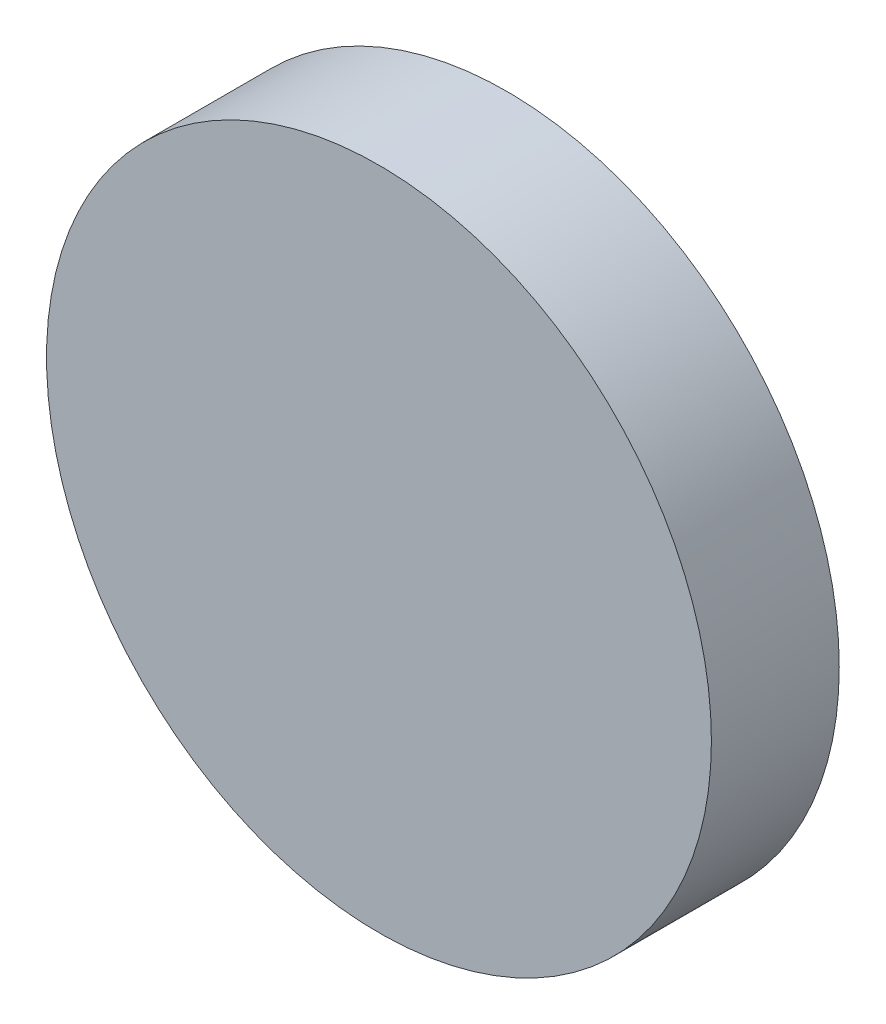
from build123d import *

# Parameters (mm, degrees)
SKETCH_1_R      = 130
EXTRUDE_1_DEPTH = 50
SKETCH_4_R      = 10
EXTRUDE_4_DEPTH = 10


with BuildPart() as part:
    # 草图1 → 凸台-拉伸1 (new body)
    with BuildSketch(Plane.XY):
        Circle(SKETCH_1_R)
    extrude(amount=EXTRUDE_1_DEPTH)

    # 草图4 → 凸台-拉伸4 (add)
    with BuildSketch(Plane(origin=(0, 0, 0), x_dir=(-1, 0, 0), z_dir=(0, 0, -1))):
        with Locations(Location((-56.568542495, 56.568542495, 0), (0, 0, 180))):
            Circle(SKETCH_4_R)
        with Locations(Location((56.568542495, 56.568542495, 0), (0, 0, 180))):
            Circle(SKETCH_4_R)
        with Locations(Location((-56.568542495, -56.568542495, 0), (0, 0, 180))):
            Circle(SKETCH_4_R)
        with Locations(Location((56.568542495, -56.568542495, 0), (0, 0, 180))):
            Circle(SKETCH_4_R)
    extrude(amount=EXTRUDE_4_DEPTH)


solid = part.part
